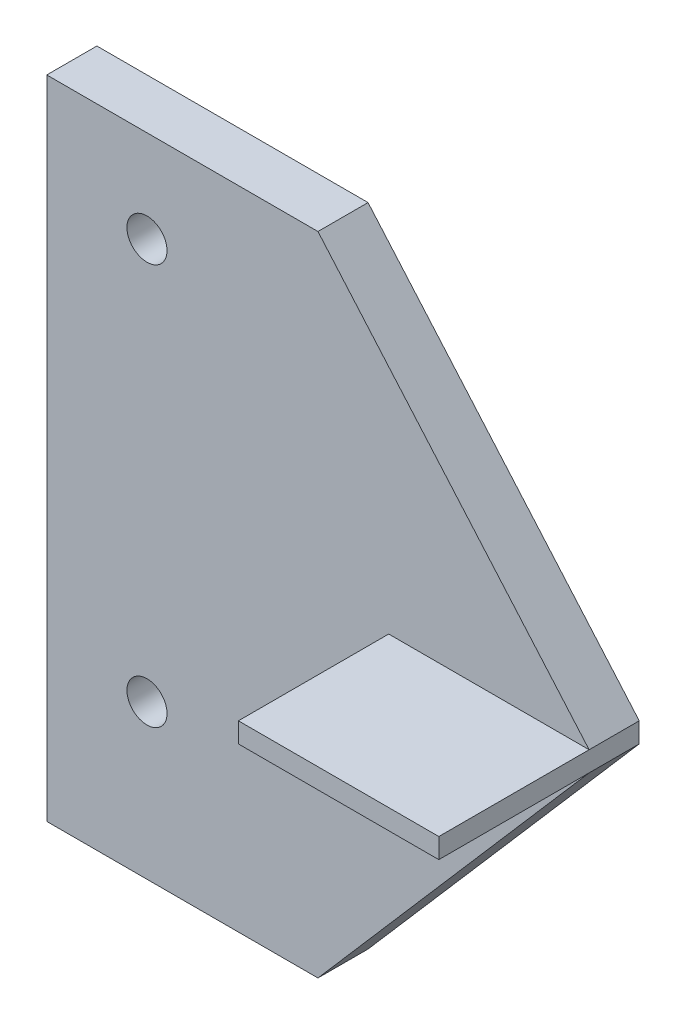
from build123d import *

# Parameters (mm, degrees)
SKETCH1_W           = 54.124737276
SKETCH1_H           = 64.519725693
SKETCH1_R           = 2
BOSS_EXTRUDE1_DEPTH = 5
SKETCH7_W           = 20
SKETCH7_H           = 2
BOSS_EXTRUDE4_DEPTH = 20
CUT_EXTRUDE4_DEPTH  = 7


with BuildPart() as part:
    # Sketch1 → Boss-Extrude1 (new body)
    with BuildSketch(Plane.XY):
        with Locations((-293.137631362, -203.073045314)):
            Rectangle(SKETCH1_W, SKETCH1_H)
        with Locations((-310.2, -180)):
            Circle(SKETCH1_R, mode=Mode.SUBTRACT)
        with Locations((-310.2, -220)):
            Circle(SKETCH1_R, mode=Mode.SUBTRACT)
    extrude(amount=BOSS_EXTRUDE1_DEPTH)

    # Sketch7 → Boss-Extrude4 (add)
    with BuildSketch(Plane(origin=(-266.075262724, 0, 0), x_dir=(0, 0, -1), z_dir=(1, 0, 0))):
        with Locations((-10, -203.073045313)):
            Rectangle(SKETCH7_W, SKETCH7_H)
    extrude(amount=-BOSS_EXTRUDE4_DEPTH)

    # Sketch8 → Cut-Extrude4 (cut)
    with BuildSketch(Plane.XY.offset(5)):
        Polygon((-266.075262724, -204.073045313), (-293.137631362, -235.33290816), (-266.075262724, -235.33290816), align=None)
        Polygon((-293.137631362, -170.813182467), (-266.075262724, -202.073045313), (-266.075262724, -170.813182467), align=None)
    extrude(amount=-CUT_EXTRUDE4_DEPTH, mode=Mode.SUBTRACT)


solid = part.part
